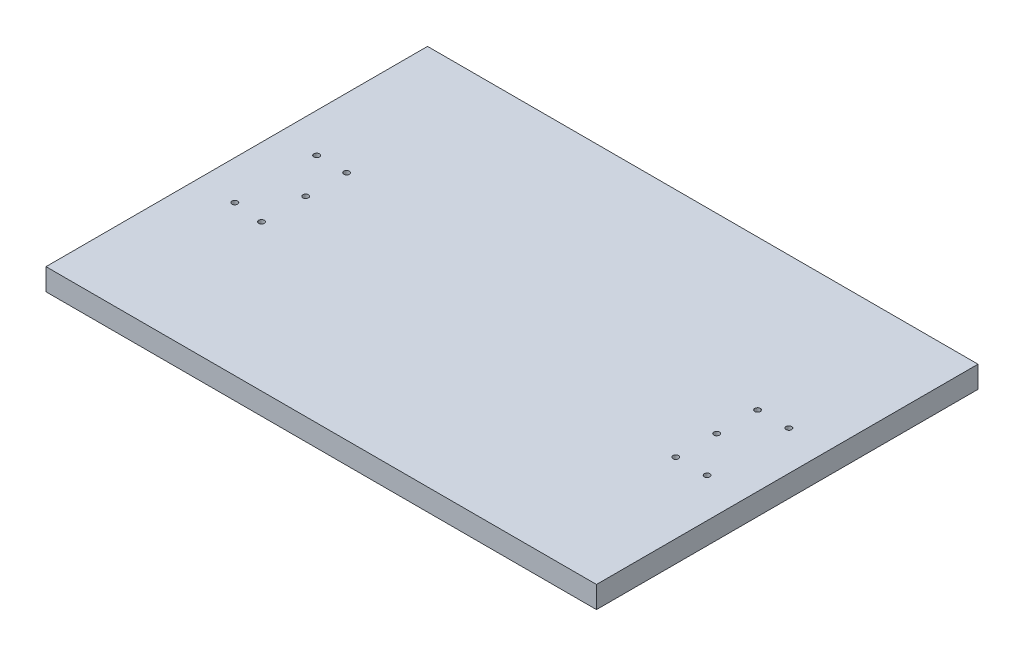
from build123d import *

# Parameters (mm, degrees)
SKETCH1_W              = 700
SKETCH1_H              = 40
BOSS_EXTRUDE1_DEPTH    = 505
M12_TAPPED_HOLE1_D     = 10.2
M12_TAPPED_HOLE1_DEPTH = 29.25
M12_TAPPED_HOLE1_TIP   = 3.064389157


with BuildPart() as part:
    # Sketch1 → Boss-Extrude1 (new, symmetric)
    with BuildSketch(Plane(origin=(0, 0, 0), x_dir=(0, 0, -1), z_dir=(1, 0, 0))):
        Rectangle(SKETCH1_W, SKETCH1_H)
    extrude(amount=BOSS_EXTRUDE1_DEPTH, both=True)

    # M12 Tapped Hole1
    with Locations(Plane(origin=(0, 20, 0), x_dir=(1, 0, 0), z_dir=(0, 1, 0))):
        with Locations((-378.5, 75.052013766), (-433.5, 75), (-378.5, -81.130993075), (-433.5, -75), (433, 75), (375.5, 75), (433, -75), (375.5, -75), (375.5, 0), (-378.5, 0)):
            Hole(M12_TAPPED_HOLE1_D / 2, depth=M12_TAPPED_HOLE1_DEPTH)
            with Locations((0, 0, -(M12_TAPPED_HOLE1_DEPTH + M12_TAPPED_HOLE1_TIP / 2))):  # 118° drill point
                Cone(0, M12_TAPPED_HOLE1_D / 2, M12_TAPPED_HOLE1_TIP, mode=Mode.SUBTRACT)


solid = part.part
